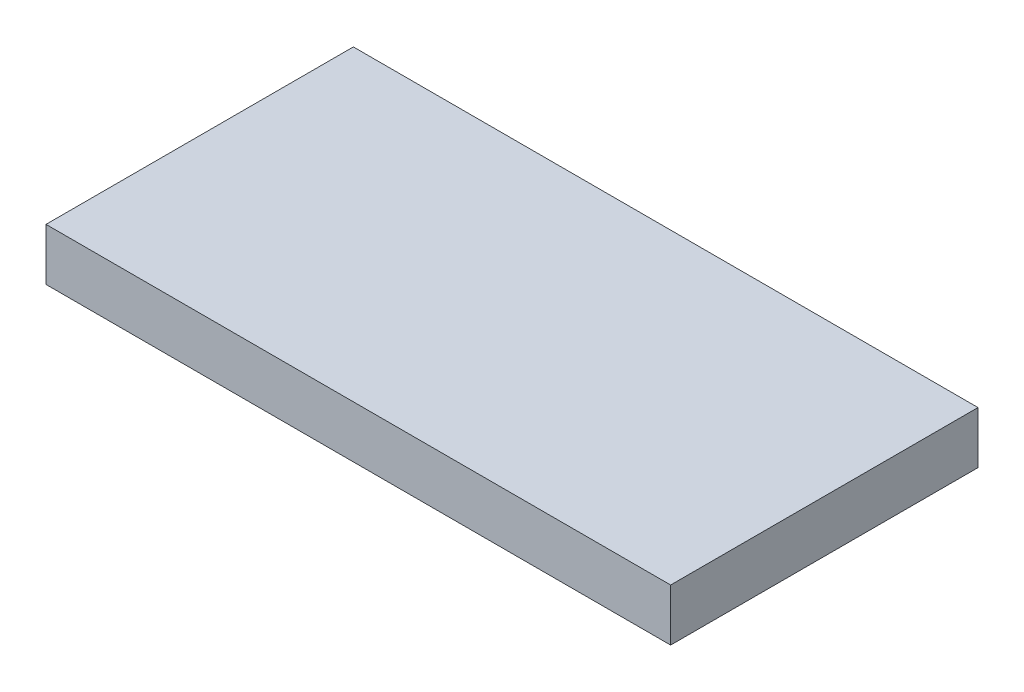
from build123d import *

# Parameters (mm, degrees)
REPLACEABLE_START                         = 27
SKETCH1_W                                 = 63
SKETCH1_H                                 = 5.25
REPLACEABLE_CROSSHEAD_BEARING_STRIP_DEPTH = 31


with BuildPart() as part:
    # Sketch1 → Replaceable crosshead bearing strip (new body)
    with BuildSketch(Plane.XY.offset(REPLACEABLE_START)):
        with Locations((70.5, 86.875)):
            Rectangle(SKETCH1_W, SKETCH1_H)
    extrude(amount=REPLACEABLE_CROSSHEAD_BEARING_STRIP_DEPTH)


solid = part.part
